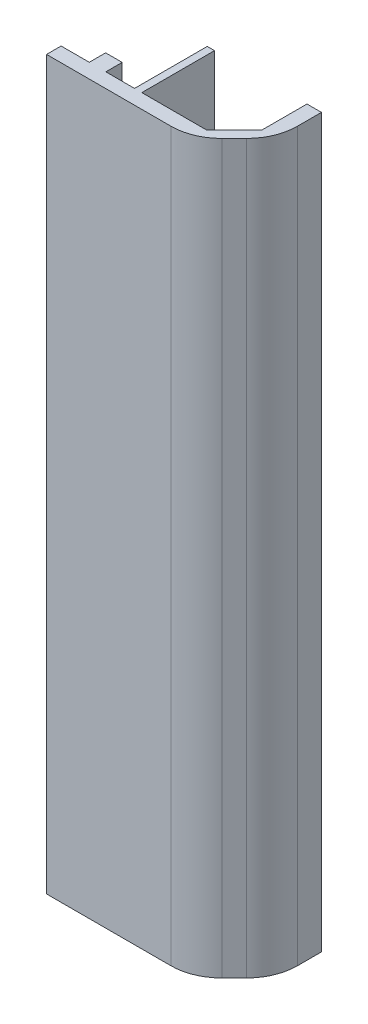
from build123d import *

# Parameters (mm, degrees)
EXTRUDE_1_DEPTH = 200
FILLET_1_R      = 14
SKETCH_2_W      = 2
SKETCH_2_H      = 200
EXTRUDE_2_DEPTH = 20


with BuildPart() as part:
    # 草圖1 → 填料-伸長1 (new body)
    with BuildSketch(Plane(origin=(0, 0, 0), x_dir=(1, 0, 0), z_dir=(0, 1, 0))):
        Polygon((-27.501723192, 6.859259259), (-22.951723192, 6.859259259), (-22.951723192, 2.359259259), (4.798276808, 2.359259259), (12.381610141, 9.942592593), (12.381610141, 22.359259259), (16.361610141, 22.359259259), (16.361610141, 9.942592593), (4.778276808, -1.640740741), (-35.251723192, -1.640740741), (-35.251723192, 2.359259259), (-27.501723192, 2.359259259), align=None)
    extrude(amount=EXTRUDE_1_DEPTH)

    # 圓角1
    fillet_1_edges = [part.edges().sort_by_distance(p)[0] for p in [
        (16.361610141, 100, -9.942592593),
        (4.778276808, 100, 1.640740741),
    ]]
    fillet(fillet_1_edges, radius=FILLET_1_R)

    # 草圖2 → 填料-伸長2 (add)
    with BuildSketch(Plane(origin=(0, 0, -2.359259259), x_dir=(-1, 0, 0), z_dir=(0, 0, -1))):
        with Locations((14.051723192, 100)):
            Rectangle(SKETCH_2_W, SKETCH_2_H)
    extrude(amount=EXTRUDE_2_DEPTH)


solid = part.part
